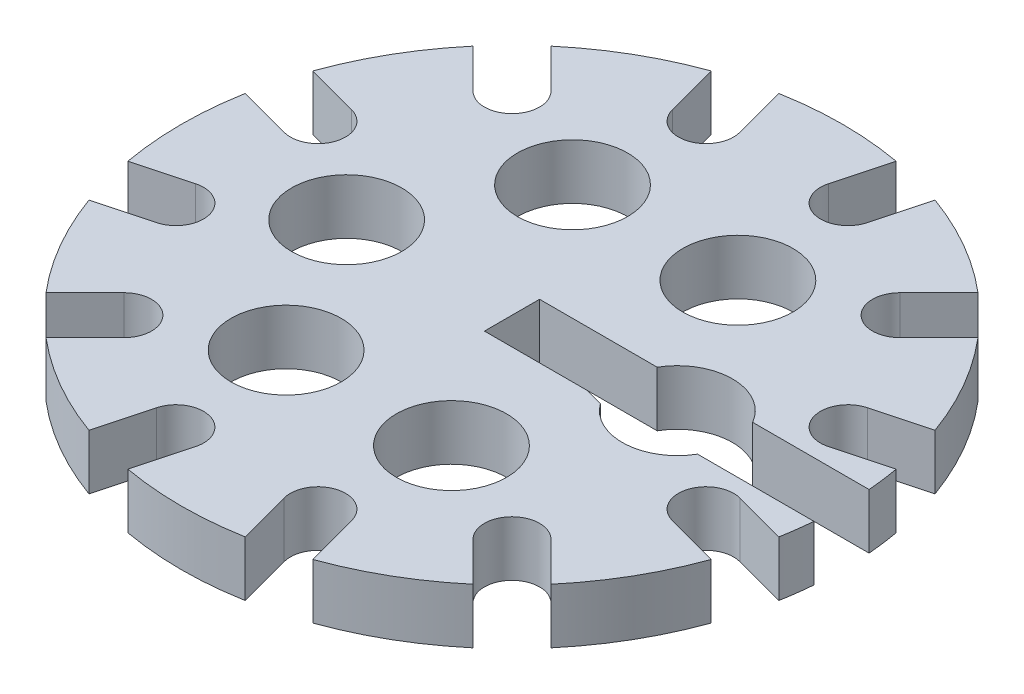
from build123d import *

# Parameters (mm, degrees)
SKETCH1_R           = 10.91
BOSS_EXTRUDE1_DEPTH = 10.91


with BuildPart() as part:
    # Sketch1 → Boss-Extrude1 (new body)
    with BuildSketch(Plane(origin=(0, 0, 0), x_dir=(1, 0, 0), z_dir=(0, 1, 0))):
        with BuildLine():
            Line((0, -5.455), (0, 5.455))
            Line((0, 5.455), (23.281662845, 5.455))
            ThreePointArc((23.281662845, 5.455), (32.73, 10.91), (42.178337155, 5.455))
            Line((42.178337155, 5.455), (65.222277444, 5.455))
            ThreePointArc((65.222277444, 5.455), (64.890066177, 8.542939281), (64.411740124, 11.611642185))
            Line((64.411740124, 11.611642185), (53.873489359, 8.787926403))
            ThreePointArc((53.873489359, 8.787926403), (47.192506085, 12.645193894), (51.049773577, 19.326177168))
            Line((51.049773577, 19.326177168), (61.588024342, 22.14989295))
            ThreePointArc((61.588024342, 22.14989295), (56.681362678, 32.725), (49.976382157, 42.261847174))
            Line((49.976382157, 42.261847174), (42.261847174, 34.547312191))
            ThreePointArc((42.261847174, 34.547312191), (34.547312191, 34.547312191), (34.547312191, 42.261847174))
            Line((34.547312191, 42.261847174), (42.261847174, 49.976382157))
            ThreePointArc((42.261847174, 49.976382157), (32.725, 56.681362678), (22.14989295, 61.588024342))
            Line((22.14989295, 61.588024342), (19.326177168, 51.049773577))
            ThreePointArc((19.326177168, 51.049773577), (12.645193894, 47.192506085), (8.787926403, 53.873489359))
            Line((8.787926403, 53.873489359), (11.611642185, 64.411740124))
            ThreePointArc((11.611642185, 64.411740124), (0, 65.45), (-11.611642185, 64.411740124))
            Line((-11.611642185, 64.411740124), (-8.787926403, 53.873489359))
            ThreePointArc((-8.787926403, 53.873489359), (-12.645193894, 47.192506085), (-19.326177168, 51.049773577))
            Line((-19.326177168, 51.049773577), (-22.14989295, 61.588024342))
            ThreePointArc((-22.14989295, 61.588024342), (-32.725, 56.681362678), (-42.261847174, 49.976382157))
            Line((-42.261847174, 49.976382157), (-34.547312191, 42.261847174))
            ThreePointArc((-34.547312191, 42.261847174), (-34.547312191, 34.547312191), (-42.261847174, 34.547312191))
            Line((-42.261847174, 34.547312191), (-49.976382157, 42.261847174))
            ThreePointArc((-49.976382157, 42.261847174), (-56.681362678, 32.725), (-61.588024342, 22.14989295))
            Line((-61.588024342, 22.14989295), (-51.049773577, 19.326177168))
            ThreePointArc((-51.049773577, 19.326177168), (-47.192506085, 12.645193894), (-53.873489359, 8.787926403))
            Line((-53.873489359, 8.787926403), (-64.411740124, 11.611642185))
            ThreePointArc((-64.411740124, 11.611642185), (-65.45, 0), (-64.411740124, -11.611642185))
            Line((-64.411740124, -11.611642185), (-53.873489359, -8.787926403))
            ThreePointArc((-53.873489359, -8.787926403), (-47.192506085, -12.645193894), (-51.049773577, -19.326177168))
            Line((-51.049773577, -19.326177168), (-61.588024342, -22.14989295))
            ThreePointArc((-61.588024342, -22.14989295), (-56.681362678, -32.725), (-49.976382157, -42.261847174))
            Line((-49.976382157, -42.261847174), (-42.261847174, -34.547312191))
            ThreePointArc((-42.261847174, -34.547312191), (-34.547312191, -34.547312191), (-34.547312191, -42.261847174))
            Line((-34.547312191, -42.261847174), (-42.261847174, -49.976382157))
            ThreePointArc((-42.261847174, -49.976382157), (-32.725, -56.681362678), (-22.14989295, -61.588024342))
            Line((-22.14989295, -61.588024342), (-19.326177168, -51.049773577))
            ThreePointArc((-19.326177168, -51.049773577), (-12.645193894, -47.192506085), (-8.787926403, -53.873489359))
            Line((-8.787926403, -53.873489359), (-11.611642185, -64.411740124))
            ThreePointArc((-11.611642185, -64.411740124), (0, -65.45), (11.611642185, -64.411740124))
            Line((11.611642185, -64.411740124), (8.787926403, -53.873489359))
            ThreePointArc((8.787926403, -53.873489359), (12.645193894, -47.192506085), (19.326177168, -51.049773577))
            Line((19.326177168, -51.049773577), (22.14989295, -61.588024342))
            ThreePointArc((22.14989295, -61.588024342), (32.725, -56.681362678), (42.261847174, -49.976382157))
            Line((42.261847174, -49.976382157), (34.547312191, -42.261847174))
            ThreePointArc((34.547312191, -42.261847174), (34.547312191, -34.547312191), (42.261847174, -34.547312191))
            Line((42.261847174, -34.547312191), (49.976382157, -42.261847174))
            ThreePointArc((49.976382157, -42.261847174), (56.681362678, -32.725), (61.588024342, -22.14989295))
            Line((61.588024342, -22.14989295), (51.049773577, -19.326177168))
            ThreePointArc((51.049773577, -19.326177168), (47.192506085, -12.645193894), (53.873489359, -8.787926403))
            Line((53.873489359, -8.787926403), (64.411740124, -11.611642185))
            ThreePointArc((64.411740124, -11.611642185), (64.890066177, -8.542939281), (65.222277444, -5.455))
            Line((65.222277444, -5.455), (42.178337155, -5.455))
            ThreePointArc((42.178337155, -5.455), (33.295026603, -10.895358871), (23.896615512, -6.403078828))
            Line((23.896615512, -6.403078828), (20.358337155, -5.455))
            Line((20.358337155, -5.455), (0, -5.455))
        make_face()
        with Locations(Location((-16.365, -28.345011466, 0), (0, 0, 270))):
            Circle(SKETCH1_R, mode=Mode.SUBTRACT)
        with Locations(Location((16.365, -28.345011466, 0), (0, 0, 270))):
            Circle(SKETCH1_R, mode=Mode.SUBTRACT)
        with Locations(Location((-32.73, 0, 0), (0, 0, 270))):
            Circle(SKETCH1_R, mode=Mode.SUBTRACT)
        with Locations(Location((-16.365, 28.345011466, 0), (0, 0, 270))):
            Circle(SKETCH1_R, mode=Mode.SUBTRACT)
        with Locations(Location((16.365, 28.345011466, 0), (0, 0, 270))):
            Circle(SKETCH1_R, mode=Mode.SUBTRACT)
    extrude(amount=BOSS_EXTRUDE1_DEPTH)


solid = part.part
